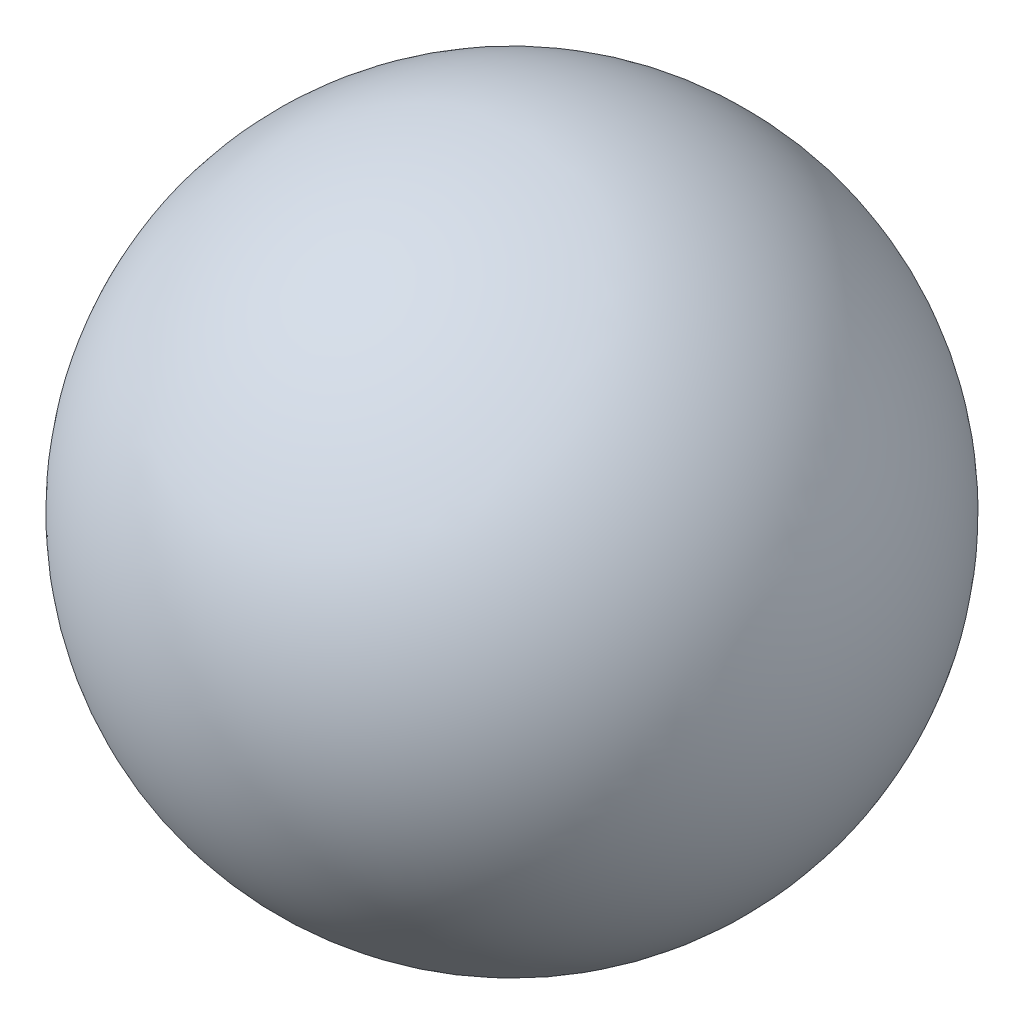
from build123d import *


with BuildPart() as part:
    # Sketch1 → Revolve1 (revolve)
    with BuildSketch(Plane.XY):
        with BuildLine():
            Line((0, 0), (14, 0))
            ThreePointArc((14, 0), (7, 7), (0, 0))
        make_face()
    revolve(axis=Axis((-924.589382604, 0, 0), (1, 0, 0)))


solid = part.part
